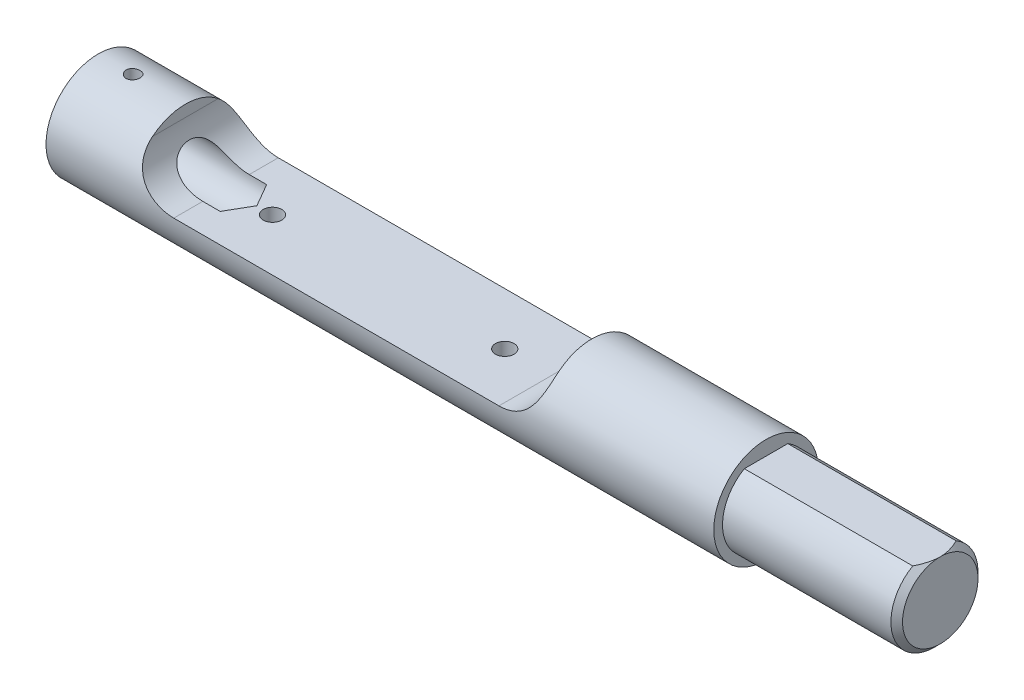
from build123d import *

# Parameters (mm, degrees)
CHANFREIN1_SIZE              = 1
ENL_V_MAT_EXTRU_1_DEPTH      = 146.557548756
ENL_V_MAT_EXTRU_1_DEPTH_BACK = 146.557548756
ESQUISSE3_W                  = 30
ESQUISSE3_H                  = 1
PER_AGE1_D                   = 8
PER_AGE1_DEPTH               = 25
PER_AGE1_TIP                 = 2.309401077
ESQUISSE6_R                  = 1.6
ENL_V_MAT_EXTRU_2_DEPTH      = 146.557548769
R_P_TITION_LIN_AIRE1_COUNT   = 2
R_P_TITION_LIN_AIRE1_PITCH   = 40
ESQUISSE7_R                  = 1.2
ENL_V_MAT_EXTRU_3_DEPTH      = 146.557548771


with BuildPart() as part:
    # Esquisse1 → Base-Révolution (revolve)
    with BuildSketch(Plane.XY, mode=Mode.PRIVATE) as base_r_volution_sk:
        Polygon((0, 0), (0, 9), (115, 9), (115, 7.5), (145, 7.5), (145, 0), align=None)
    revolve(base_r_volution_sk.sketch.rotate(Axis((0, 0, 0), (1, 0, 0)), 90), axis=Axis((0, 0, 0), (1, 0, 0)))

    # Chanfrein1
    chanfrein1_edges = [part.edges().sort_by_distance(p)[0] for p in [
        (145, 0, -7.5),
    ]]
    chamfer(chanfrein1_edges, length=CHANFREIN1_SIZE)

    # Esquisse3 → Enlèv. mat.-Extru.1 (cut, two sides: drawn at the far end of the back side and taken through both)
    with BuildSketch(Plane.XY.offset(-ENL_V_MAT_EXTRU_1_DEPTH_BACK)):
        with Locations((130, 7)):
            Rectangle(ESQUISSE3_W, ESQUISSE3_H)
        with BuildLine():
            Line((85, 9), (15, 9))
            Line((15, 9), (15, 7))
            ThreePointArc((15, 7), (17.050252532, 2.050252532), (22, 0))
            Line((22, 0), (78, 0))
            ThreePointArc((78, 0), (82.949747468, 2.050252532), (85, 7))
            Line((85, 7), (85, 9))
        make_face()
    extrude(amount=ENL_V_MAT_EXTRU_1_DEPTH + ENL_V_MAT_EXTRU_1_DEPTH_BACK, mode=Mode.SUBTRACT)

    # Perçage1
    with Locations(Plane.ZY):
        with Locations((0, 0)):
            Hole(PER_AGE1_D / 2, depth=PER_AGE1_DEPTH)
            with Locations((0, 0, -(PER_AGE1_DEPTH + PER_AGE1_TIP / 2))):  # 120° drill point
                Cone(0, PER_AGE1_D / 2, PER_AGE1_TIP, mode=Mode.SUBTRACT)

    # Esquisse6 → Enlèv. mat.-Extru.2 (cut, through all)
    with BuildSketch(Plane(origin=(0, 0, 0), x_dir=(-1, 0, 0), z_dir=(0, 1, 0))):
        with Locations(Location((-30, 0, 0), (0, 0, 90))):
            Circle(ESQUISSE6_R)
    enl_v_mat_extru_2 = extrude(amount=-ENL_V_MAT_EXTRU_2_DEPTH, mode=Mode.SUBTRACT)

    # Répétition linéaire1: Enlèv. mat.-Extru.2 ×2
    with Locations(*[(i * R_P_TITION_LIN_AIRE1_PITCH, 0, 0) for i in range(1, R_P_TITION_LIN_AIRE1_COUNT)]):
        add(enl_v_mat_extru_2, mode=Mode.SUBTRACT)

    # Esquisse7 → Enlèv. mat.-Extru.3 (cut, through all)
    with BuildSketch(Plane(origin=(0, 0, 0), x_dir=(-1, 0, 0), z_dir=(0, 1, 0))):
        with Locations(Location((-6, 0, 0), (0, 0, 270))):
            Circle(ESQUISSE7_R)
    extrude(amount=ENL_V_MAT_EXTRU_3_DEPTH, mode=Mode.SUBTRACT)


solid = part.part
